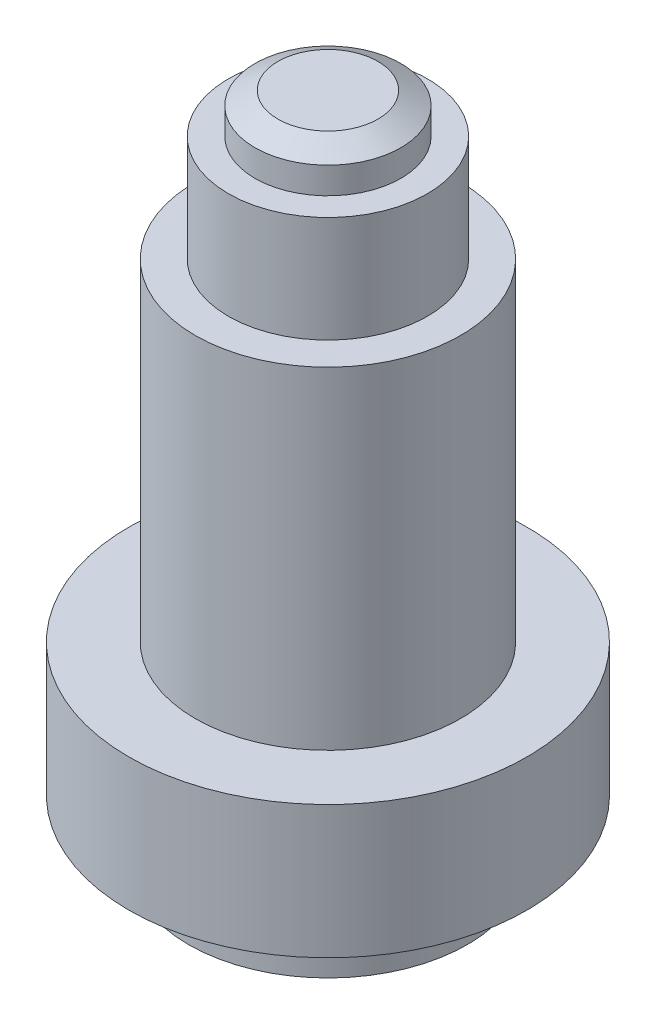
from build123d import *

# Parameters (mm, degrees)
SKETCH1_R           = 10.5
BOSS_EXTRUDE1_DEPTH = 4.5
SKETCH2_R           = 15
BOSS_EXTRUDE2_DEPTH = 10
SKETCH3_R           = 10
BOSS_EXTRUDE3_DEPTH = 25
SKETCH4_R           = 7.5
BOSS_EXTRUDE4_DEPTH = 8
SKETCH5_R           = 5.5
BOSS_EXTRUDE5_DEPTH = 3
CHAMFER1_SIZE       = 1
CHAMFER1_SIZE2      = 1.732050808


with BuildPart() as part:
    # Sketch1 → Boss-Extrude1 (new body)
    with BuildSketch(Plane(origin=(0, 0, 0), x_dir=(1, 0, 0), z_dir=(0, 1, 0))):
        with Locations(Location((0, 0, 0), (0, 0, 270))):
            Circle(SKETCH1_R)
    extrude(amount=BOSS_EXTRUDE1_DEPTH)

    # Sketch2 → Boss-Extrude2 (add)
    with BuildSketch(Plane(origin=(0, 4.5, 0), x_dir=(1, 0, 0), z_dir=(0, 1, 0))):
        with Locations(Location((0, 0, 0), (0, 0, 270))):
            Circle(SKETCH2_R)
    extrude(amount=BOSS_EXTRUDE2_DEPTH)

    # Sketch3 → Boss-Extrude3 (add)
    with BuildSketch(Plane(origin=(0, 14.5, 0), x_dir=(1, 0, 0), z_dir=(0, 1, 0))):
        with Locations(Location((0, 0, 0), (0, 0, 270))):
            Circle(SKETCH3_R)
    extrude(amount=BOSS_EXTRUDE3_DEPTH)

    # Sketch4 → Boss-Extrude4 (add)
    with BuildSketch(Plane(origin=(0, 39.5, 0), x_dir=(1, 0, 0), z_dir=(0, 1, 0))):
        with Locations(Location((0, 0, 0), (0, 0, 270))):
            Circle(SKETCH4_R)
    extrude(amount=BOSS_EXTRUDE4_DEPTH)

    # Sketch5 → Boss-Extrude5 (add)
    with BuildSketch(Plane(origin=(0, 47.5, 0), x_dir=(1, 0, 0), z_dir=(0, 1, 0))):
        with Locations(Location((0, 0, 0), (0, 0, 270))):
            Circle(SKETCH5_R)
    extrude(amount=BOSS_EXTRUDE5_DEPTH)

    # Chamfer1
    chamfer1_edges = [part.edges().sort_by_distance(p)[0] for p in [
        (0, 50.5, -5.5),
    ]]
    chamfer1_side = [part.faces().sort_by_distance(p)[0] for p in [
        (0, 49, -5.5),
    ]]
    chamfer(chamfer1_edges, length=CHAMFER1_SIZE, length2=CHAMFER1_SIZE2, reference=chamfer1_side[0])


solid = part.part
